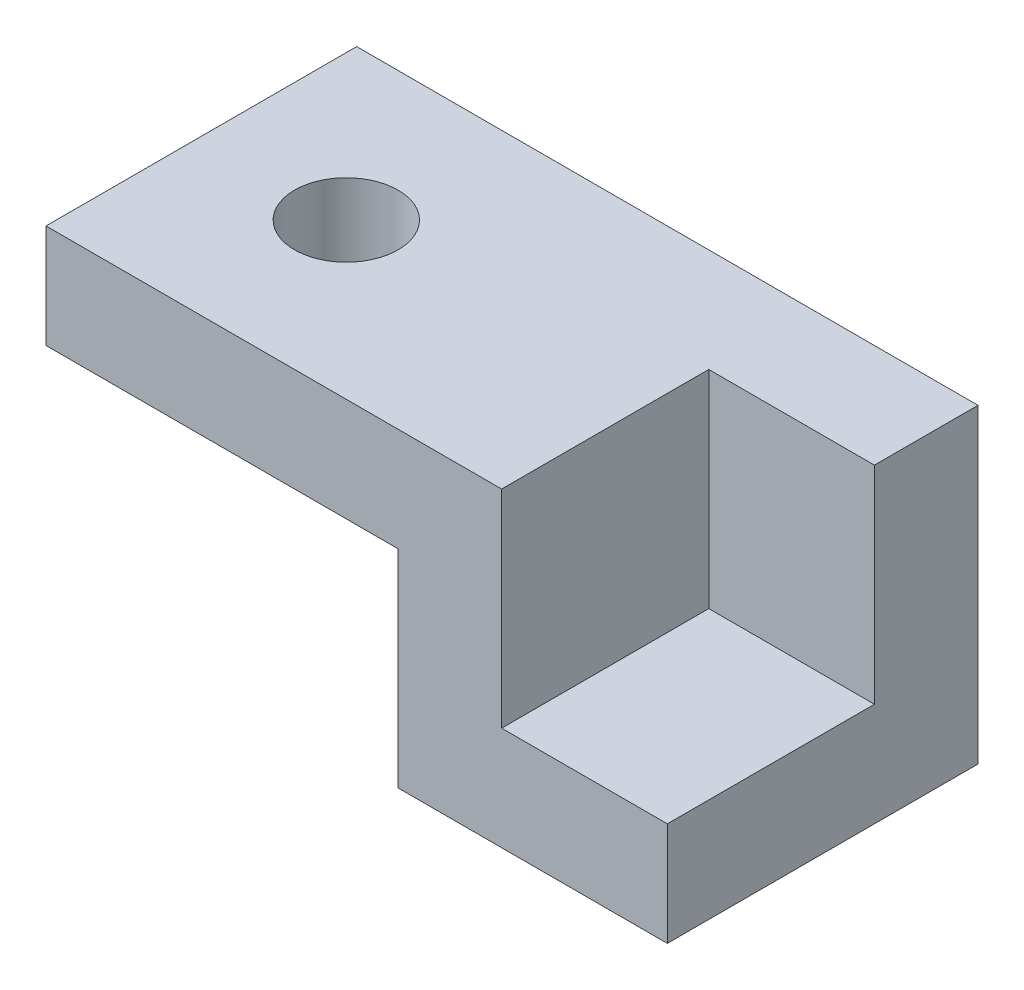
from build123d import *

# Parameters (mm, degrees)
BOSS_EXTRUDE1_DEPTH = 75
SKETCH4_W           = 40
SKETCH4_H           = 50
CUT_EXTRUDE1_DEPTH  = 50
SKETCH5_R           = 12.5
CUT_EXTRUDE2_DEPTH  = 25


with BuildPart() as part:
    # Sketch2 → Boss-Extrude1 (new body)
    with BuildSketch(Plane.XY):
        Polygon((0, 0), (-65, 0), (-65, 50), (-150, 50), (-150, 75), (0, 75), align=None)
    extrude(amount=BOSS_EXTRUDE1_DEPTH)

    # Sketch4 → Cut-Extrude1 (cut)
    with BuildSketch(Plane.XY.offset(75)):
        with Locations((-20, 50)):
            Rectangle(SKETCH4_W, SKETCH4_H)
    extrude(amount=-CUT_EXTRUDE1_DEPTH, mode=Mode.SUBTRACT)

    # Sketch5 → Cut-Extrude2 (cut)
    with BuildSketch(Plane(origin=(0, 75, 0), x_dir=(1, 0, 0), z_dir=(0, 1, 0))):
        with Locations(Location((-115, -37.5, 0), (0, 0, 180))):
            Circle(SKETCH5_R)
    extrude(amount=-CUT_EXTRUDE2_DEPTH, mode=Mode.SUBTRACT)


solid = part.part
